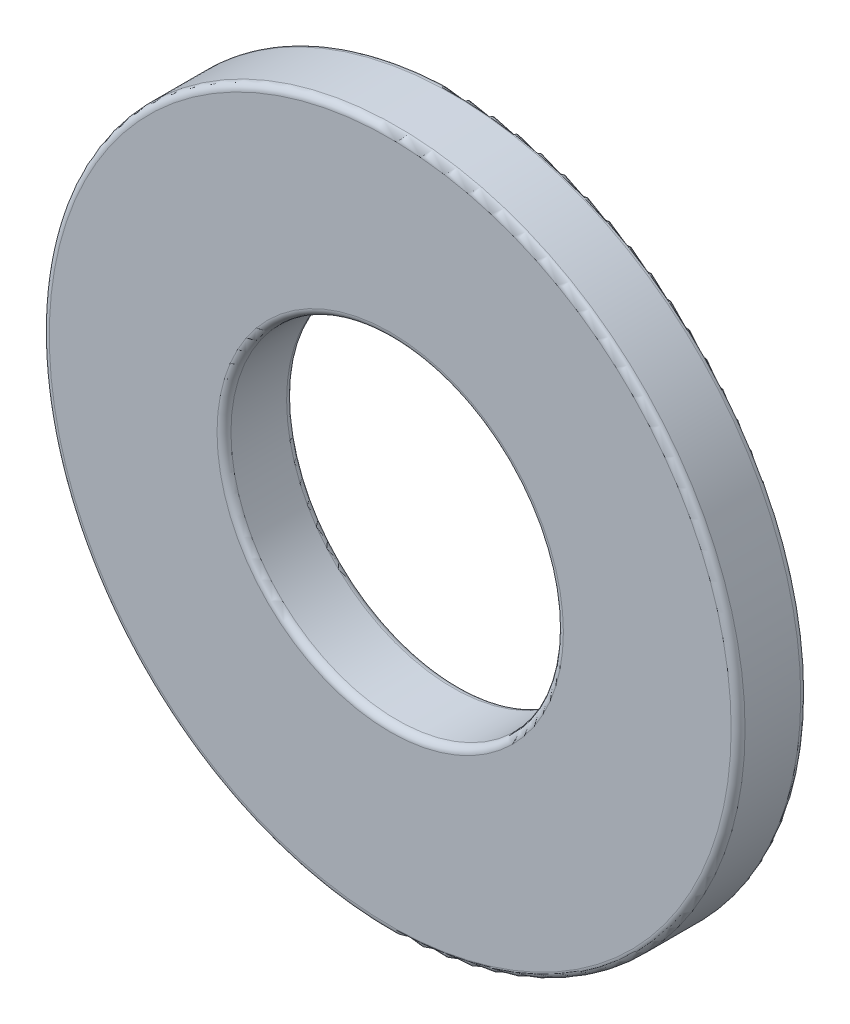
from build123d import *

# Parameters (mm, degrees)
BOSS_EXTRUDE1_DEPTH      = 0.45
BOSS_EXTRUDE1_DEPTH_BACK = 0.45
SKETCH3_R                = 4.5
SKETCH3_R_2              = 2.15
FILLET1_R                = 0.09


with BuildPart() as part:
    # Sketch3 → Boss-Extrude1 (new, two sides: drawn at the far end of the back side and taken through both)
    with BuildSketch(Plane.XY.offset(-BOSS_EXTRUDE1_DEPTH_BACK)):
        Circle(SKETCH3_R)
        Circle(SKETCH3_R_2, mode=Mode.SUBTRACT)
    extrude(amount=BOSS_EXTRUDE1_DEPTH + BOSS_EXTRUDE1_DEPTH_BACK)

    # Fillet1
    fillet1_edges = [part.edges().sort_by_distance(p)[0] for p in [
        (-4.5, 0, -0.45),
        (-2.15, 0, -0.45),
        (-4.5, 0, 0.45),
        (-2.15, 0, 0.45),
    ]]
    fillet(fillet1_edges, radius=FILLET1_R)


solid = part.part
